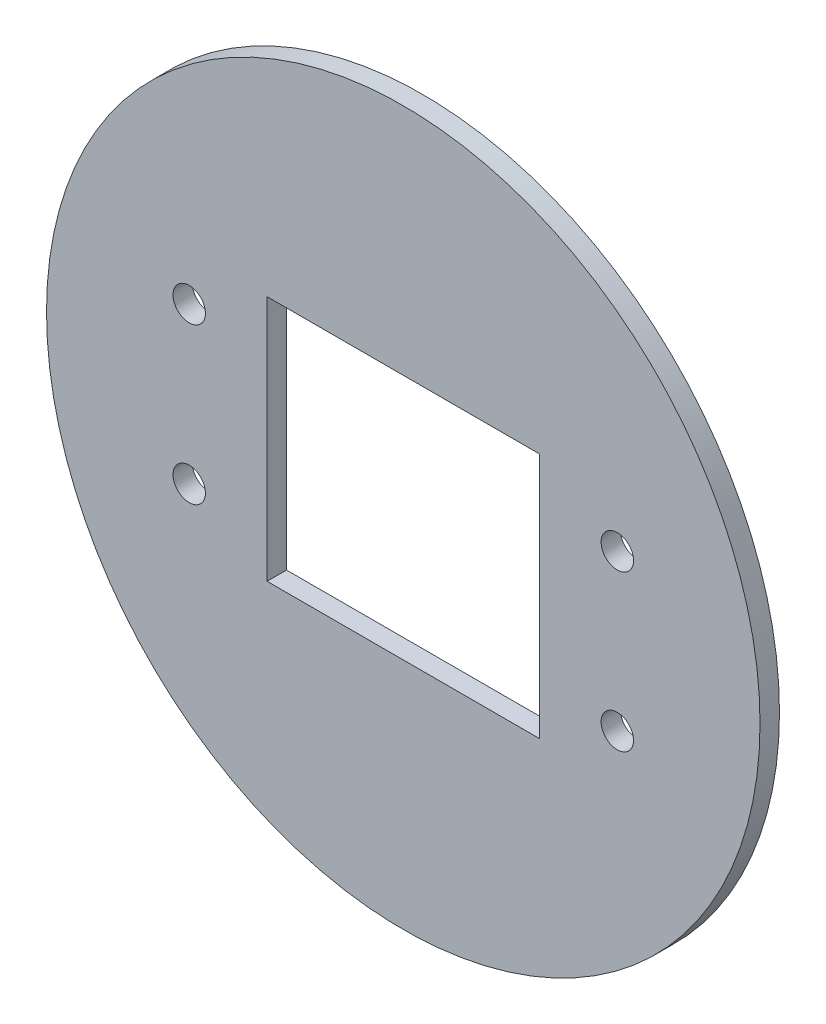
from build123d import *

# Parameters (mm, degrees)
SKETCH_2_R          = 27.5
SKETCH_2_W          = 21
SKETCH_2_H          = 19
EXTRUDE_2_DEPTH     = 1.5
SKETCH_3_R          = 1.25
CUT_EXTRUDE_1_DEPTH = 10


with BuildPart() as part:
    # 草图2 → 凸台-拉伸2 (new body)
    with BuildSketch(Plane.XY):
        Circle(SKETCH_2_R)
        Rectangle(SKETCH_2_W, SKETCH_2_H, mode=Mode.SUBTRACT)
    extrude(amount=EXTRUDE_2_DEPTH)

    # 草图3 → 切除-拉伸1 (cut)
    with BuildSketch(Plane.XY.offset(1.5)):
        with Locations((16.5, 6)):
            Circle(SKETCH_3_R)
        with Locations((-16.5, 6)):
            Circle(SKETCH_3_R)
        with Locations((16.5, -6)):
            Circle(SKETCH_3_R)
        with Locations((-16.5, -6)):
            Circle(SKETCH_3_R)
    extrude(amount=-CUT_EXTRUDE_1_DEPTH, mode=Mode.SUBTRACT)


solid = part.part
